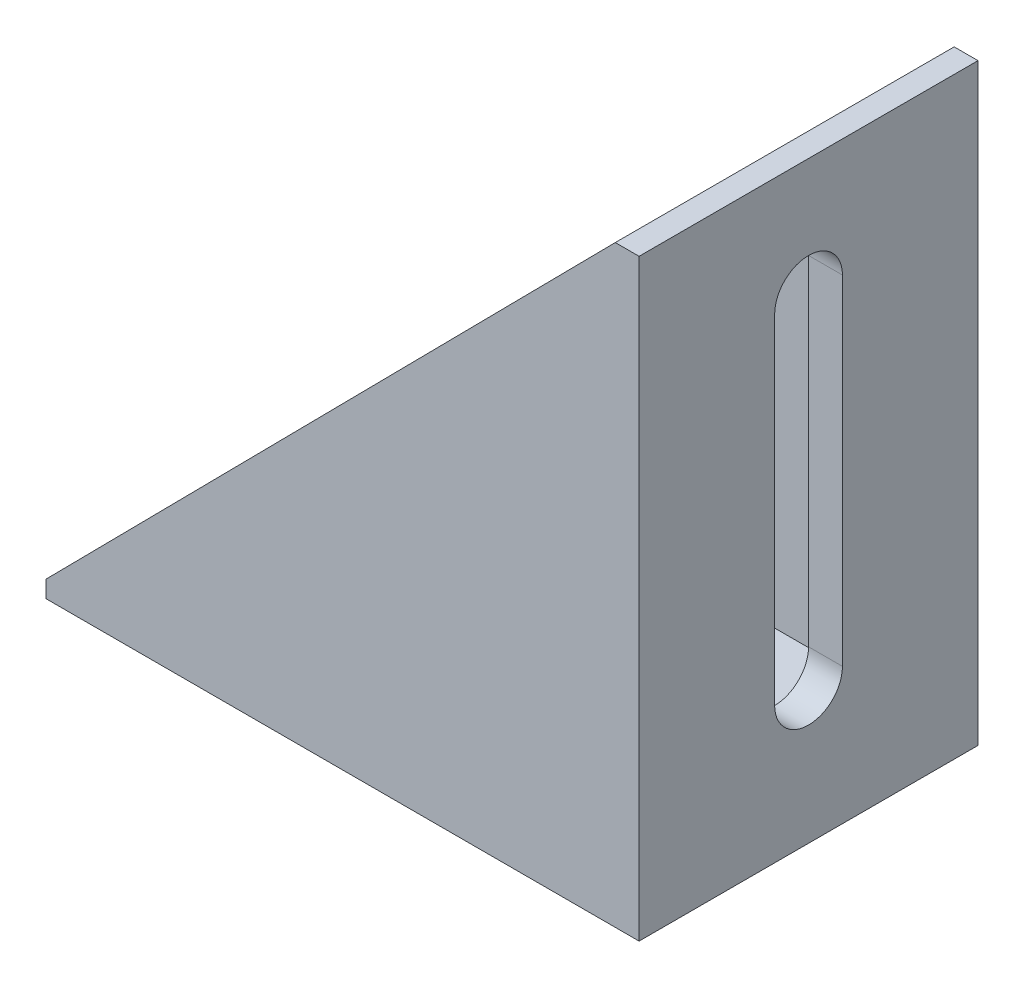
from build123d import *

# Parameters (mm, degrees)
EXTRUDE_3_DEPTH     = 10
CUT_EXTRUDE_2_DEPTH = 8
CUT_EXTRUDE_4_DEPTH = 8
CUT_EXTRUDE_5_DEPTH = 8


with BuildPart() as part:
    # 草图1 → 凸台-拉伸3 (new body)
    with BuildSketch(Plane.XY):
        Polygon((0, 0), (35, 0), (35, 35), (33.594225436, 35), (0, 1), align=None)
    extrude(amount=EXTRUDE_3_DEPTH)

    # 草图4 → 切除-拉伸2 (cut)
    with BuildSketch(Plane.XY.offset(10)):
        Polygon((3.799665242, 2), (33, 2), (33, 31.553036836), (33, 35.783784072), (-1.057608141, 2), align=None)
    extrude(amount=-CUT_EXTRUDE_2_DEPTH, mode=Mode.SUBTRACT)

    # 草图7 → 切除-拉伸4 (cut)
    with BuildSketch(Plane(origin=(0, 2, 0), x_dir=(1, 0, 0), z_dir=(0, 1, 0))):
        with BuildLine():
            Line((7.669292291, -8), (27.669292291, -8))
            ThreePointArc((27.669292291, -8), (29.669292291, -10), (27.669292291, -12))
            Line((27.669292291, -12), (7.669292291, -12))
            ThreePointArc((7.669292291, -12), (5.669292291, -10), (7.669292291, -8))
        make_face()
    extrude(amount=-CUT_EXTRUDE_4_DEPTH, mode=Mode.SUBTRACT)

    # 草图8 → 切除-拉伸5 (cut)
    with BuildSketch(Plane.ZY.offset(-33)):
        with BuildLine():
            Line((12, 28.042571575), (12, 8.042571575))
            ThreePointArc((12, 8.042571575), (10, 6.042571575), (8, 8.042571575))
            Line((8, 8.042571575), (8, 28.042571575))
            ThreePointArc((8, 28.042571575), (10, 30.042571575), (12, 28.042571575))
        make_face()
    extrude(amount=-CUT_EXTRUDE_5_DEPTH, mode=Mode.SUBTRACT)

    # 镜向3: part across plane


with BuildPart() as part_1:
    add(part.part)
    add(part.part.mirror(Plane(origin=(0, 35, 10), x_dir=(1, 0, 0), z_dir=(0, 0, 1))))


solid = part_1.part
